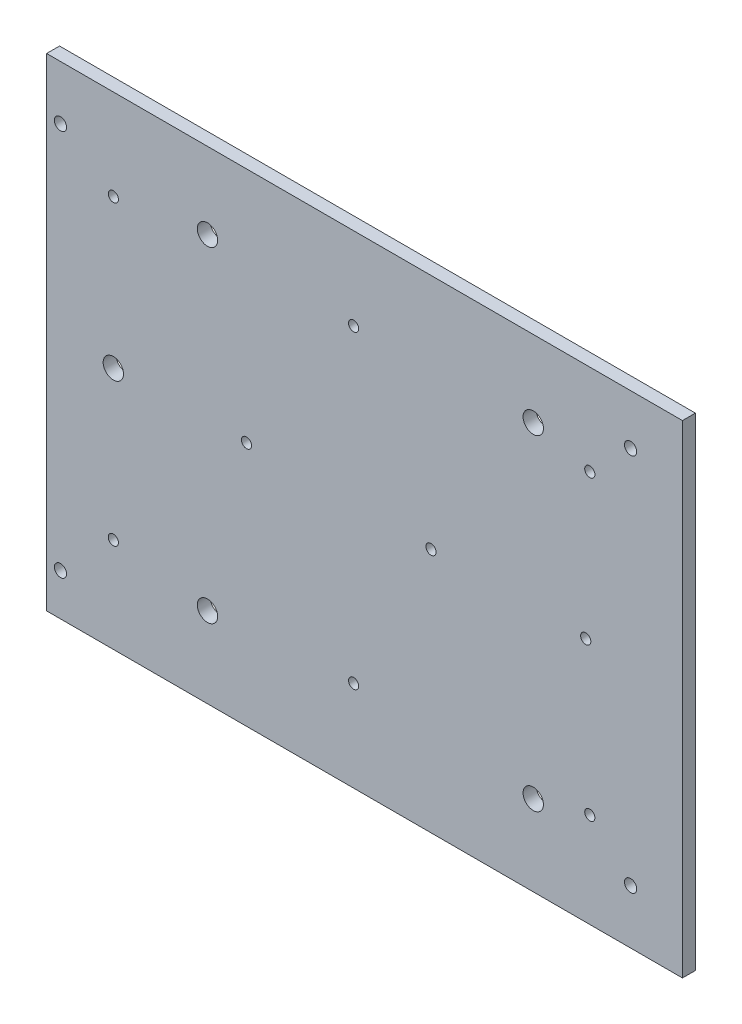
from build123d import *

# Parameters (mm, degrees)
SKETCH10_W            = 156.133449978
SKETCH10_H            = 118.545046658
BOSS_EXTRUDE2_DEPTH   = 3.175
F_5_0MM_DOWEL_HOLE1_D = 5
F_3_0MM_DOWEL_HOLE1_D = 3
F_2_5MM_DOWEL_HOLE1_D = 2.5
F_2_5MM_DOWEL_HOLE2_D = 2.5
F_5_0MM_DOWEL_HOLE2_D = 5


with BuildPart() as part:
    # Sketch10 → Boss-Extrude2 (new body)
    with BuildSketch(Plane.XY):
        with Locations((145.019399685, -105.793370226)):
            Rectangle(SKETCH10_W, SKETCH10_H)
    extrude(amount=BOSS_EXTRUDE2_DEPTH)

    # Ø5.0mm Dowel Hole1 (through all)
    with Locations(Plane.XY.offset(3.175)):
        with Locations((106.452674696, -65.270846897), (186.452674696, -65.270846897), (186.452674696, -145.270846897), (106.452674696, -145.270846897)):
            Hole(F_5_0MM_DOWEL_HOLE1_D / 2)

    # Ø3.0mm Dowel Hole1 (through all)
    with Locations(Plane(origin=(0, 0, 0), x_dir=(-1, 0, 0), z_dir=(0, 0, -1))):
        with Locations((-210.352674696, -58.770846897), (-210.352674696, -151.770846897), (-70.352674696, -154.770846897), (-70.352674696, -59.770846897)):
            Hole(F_3_0MM_DOWEL_HOLE1_D / 2)

    # Ø2.5mm Dowel Hole1 (through all)
    with Locations(Plane(origin=(0, 0, 0), x_dir=(-1, 0, 0), z_dir=(0, 0, -1))):
        with Locations((-200.336124674, -68.770846897), (-83.336124674, -68.770846897), (-83.336124674, -141.770846897), (-200.336124674, -141.770846897)):
            Hole(F_2_5MM_DOWEL_HOLE1_D / 2)

    # Ø2.5mm Dowel Hole2 (through all)
    with Locations(Plane(origin=(0, 0, 0), x_dir=(-1, 0, 0), z_dir=(0, 0, -1))):
        with Locations((-199.336124674, -104.770846897), (-161.336124674, -104.770846897), (-116.036124674, -104.770846897), (-142.336124674, -66.770846897), (-142.336124674, -142.770846897)):
            Hole(F_2_5MM_DOWEL_HOLE2_D / 2)

    # Ø5.0mm Dowel Hole2 (through all)
    with Locations(Plane(origin=(0, 0, 0), x_dir=(-1, 0, 0), z_dir=(0, 0, -1))):
        with Locations((-83.336124674, -105.270846897)):
            Hole(F_5_0MM_DOWEL_HOLE2_D / 2)


solid = part.part
